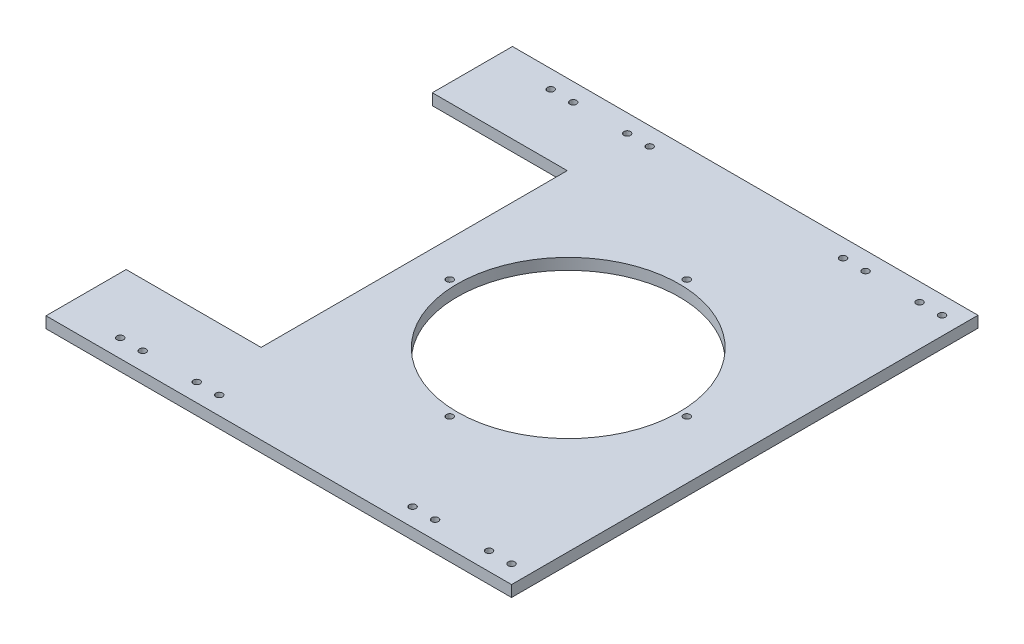
from build123d import *

# Parameters (mm, degrees)
SKETCH1_W             = 262.89
SKETCH1_H             = 263.40054
SKETCH1_R             = 62.6745
BOSS_EXTRUDE1_DEPTH   = 6.35
F_6_CLEARANCE_HOLE1_D = 3.7973
F_6_CLEARANCE_HOLE2_D = 3.7973
F_6_CLEARANCE_HOLE3_D = 3.7973
SKETCH9_W             = 76.2
SKETCH9_H             = 172.887951896
CUT_EXTRUDE1_DEPTH    = 7.62


with BuildPart() as part:
    # Sketch1 → Boss-Extrude1 (new body)
    with BuildSketch(Plane(origin=(0, 0, 0), x_dir=(1, 0, 0), z_dir=(0, 1, 0))):
        Rectangle(SKETCH1_W, SKETCH1_H)
        with Locations(Location((31.75, 0, 0), (0, 0, 270))):
            Circle(SKETCH1_R, mode=Mode.SUBTRACT)
    extrude(amount=BOSS_EXTRUDE1_DEPTH)

    # #6 Clearance Hole1 (through all)
    with Locations(Plane(origin=(0, 6.35, 0), x_dir=(1, 0, 0), z_dir=(0, 1, 0))):
        with Locations((31.75, 66.94678), (-35.19678, 0), (98.69678, 0), (31.75, -66.94678)):
            Hole(F_6_CLEARANCE_HOLE1_D / 2)

    # #6 Clearance Hole2 (through all)
    with Locations(Plane(origin=(0, 6.35, 0), x_dir=(1, 0, 0), z_dir=(0, 1, 0))):
        with Locations((121.285, -121.54027), (108.585, -121.54027), (78.105, -121.54027), (65.405, -121.54027)):
            f_6_clearance_hole2 = Hole(F_6_CLEARANCE_HOLE2_D / 2)

    # Mirror1: #6 Clearance Hole2 across plane
    add(f_6_clearance_hole2.mirror(Plane.XY), mode=Mode.SUBTRACT)

    # #6 Clearance Hole3 (through all)
    with Locations(Plane(origin=(0, 6.35, 0), x_dir=(1, 0, 0), z_dir=(0, 1, 0))):
        with Locations((-43.815, -121.54027), (-56.515, -121.54027), (-86.995, -121.54027), (-99.695, -121.54027)):
            f_6_clearance_hole3 = Hole(F_6_CLEARANCE_HOLE3_D / 2)

    # Mirror2: #6 Clearance Hole3 across plane
    add(f_6_clearance_hole3.mirror(Plane.XY), mode=Mode.SUBTRACT)

    # Sketch9 → Cut-Extrude1 (cut)
    with BuildSketch(Plane(origin=(0, 6.35, 0), x_dir=(1, 0, 0), z_dir=(0, 1, 0))):
        with Locations((-93.345, 0)):
            Rectangle(SKETCH9_W, SKETCH9_H)
    extrude(amount=-CUT_EXTRUDE1_DEPTH, mode=Mode.SUBTRACT)


solid = part.part
